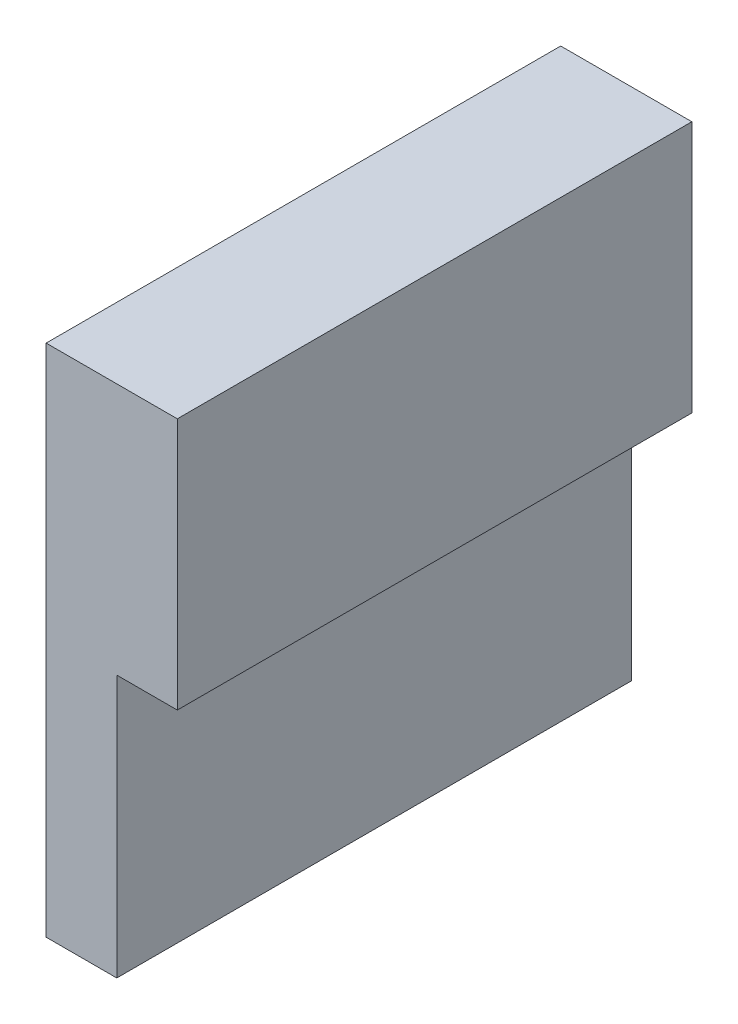
from build123d import *

# Parameters (mm, degrees)
SKETCH1_W           = 51
SKETCH1_H           = 51
BOSS_EXTRUDE1_DEPTH = 13
SKETCH2_W           = 51
SKETCH2_H           = 26
CUT_EXTRUDE1_DEPTH  = 6


with BuildPart() as part:
    # Sketch1 → Boss-Extrude1 (new body)
    with BuildSketch(Plane(origin=(0, 0, 0), x_dir=(0, 0, -1), z_dir=(1, 0, 0))):
        with Locations((-25.5, -25.5)):
            Rectangle(SKETCH1_W, SKETCH1_H)
    extrude(amount=BOSS_EXTRUDE1_DEPTH)

    # Sketch2 → Cut-Extrude1 (cut)
    with BuildSketch(Plane(origin=(13, 0, 0), x_dir=(0, 0, -1), z_dir=(1, 0, 0))):
        with Locations((-25.5, -38)):
            Rectangle(SKETCH2_W, SKETCH2_H)
    extrude(amount=-CUT_EXTRUDE1_DEPTH, mode=Mode.SUBTRACT)


solid = part.part
